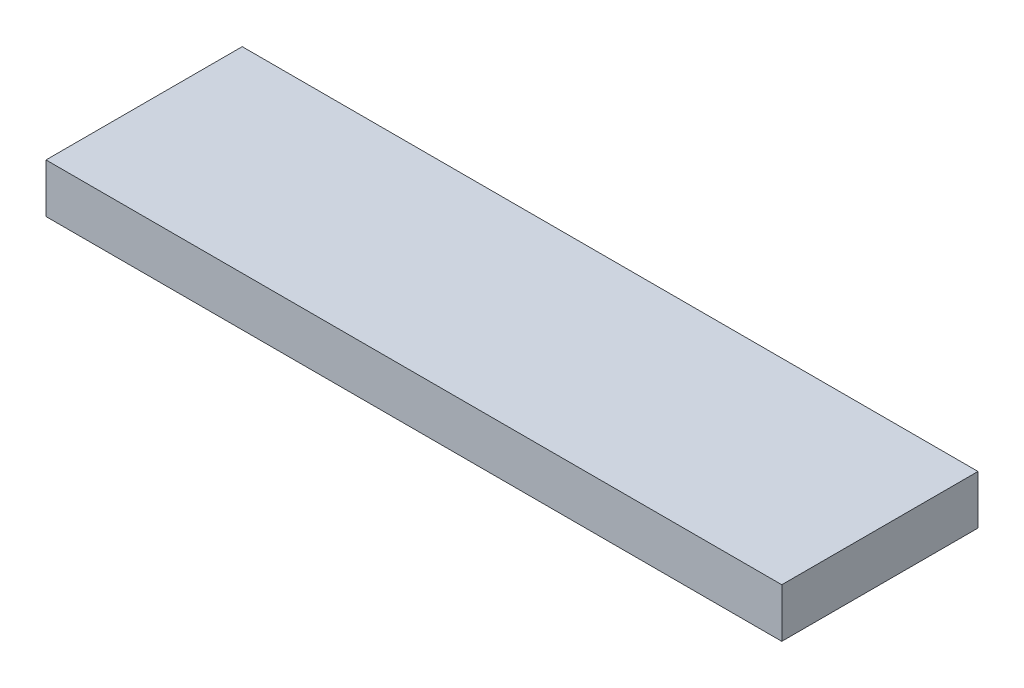
from build123d import *

# Parameters (mm, degrees)
SKETCH1_W           = 30
SKETCH1_H           = 8
BOSS_EXTRUDE1_DEPTH = 2


with BuildPart() as part:
    # Sketch1 → Boss-Extrude1 (new body)
    with BuildSketch(Plane(origin=(0, 0, 0), x_dir=(1, 0, 0), z_dir=(0, 1, 0))):
        with Locations((15, 4)):
            Rectangle(SKETCH1_W, SKETCH1_H)
    extrude(amount=BOSS_EXTRUDE1_DEPTH)


solid = part.part
